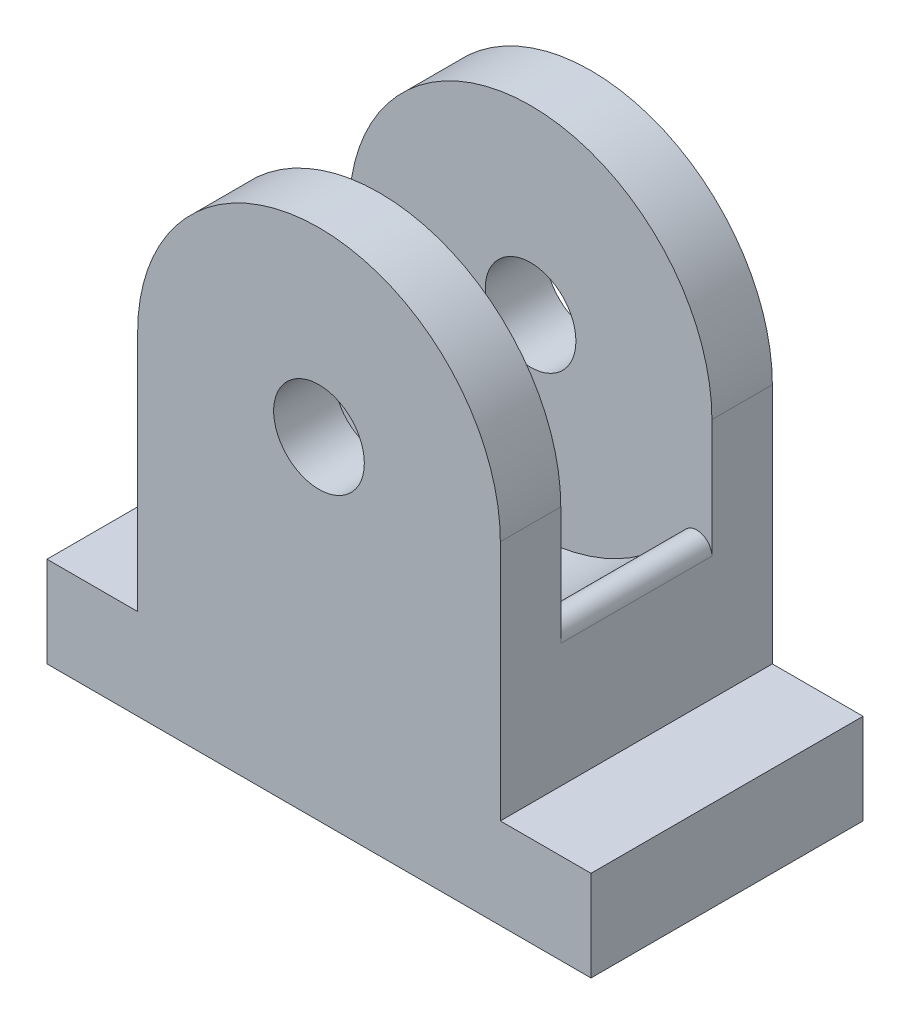
from build123d import *

# Parameters (mm, degrees)
SKETCH_1_R               = 1.5
EXTRUDE_1_DEPTH          = 2
SKETCH_2_W               = 18
SKETCH_2_H               = 3
EXTRUDE_2_DEPTH          = 2.5
EXTRUDE_3_DEPTH          = 2.5
FILLET_1_R               = 0.5
FILLET_2_R               = 0.5
CUT_EXTRUDE_1_DEPTH      = 22.236760582
CUT_EXTRUDE_1_DEPTH_BACK = 10
SKETCH_6_R               = 1.35


with BuildPart() as part:
    # 草图1 → 凸台-拉伸1 (new body)
    with BuildSketch(Plane.XY):
        with BuildLine():
            Line((-6, 0), (-6, -8))
            Line((-6, -8), (-9, -8))
            Line((-9, -8), (-9, -11))
            Line((-9, -11), (9, -11))
            Line((9, -11), (9, -8))
            Line((9, -8), (6, -8))
            Line((6, -8), (6, 0))
            ThreePointArc((6, 0), (0, 6), (-6, 0))
        make_face()
        Circle(SKETCH_1_R, mode=Mode.SUBTRACT)
    extrude(amount=EXTRUDE_1_DEPTH)

    # 草图2 → 凸台-拉伸2 (add)
    with BuildSketch(Plane.XY.offset(2)):
        with Locations((0, -9.5)):
            Rectangle(SKETCH_2_W, SKETCH_2_H)
    extrude(amount=EXTRUDE_2_DEPTH)

    # 草图5 → 凸台-拉伸3 (add)
    with BuildSketch(Plane.XY.offset(2)):
        with BuildLine():
            Line((6, -1.75), (6, -8))
            Line((6, -8), (-6, -8))
            Line((-6, -8), (-6, -1.75))
            ThreePointArc((-6, -1.75), (0, -6.25), (6, -1.75))
        make_face()
    extrude(amount=EXTRUDE_3_DEPTH)

    # 圆角1
    fillet_1_edges = [part.edges().sort_by_distance(p)[0] for p in [
        (-6, -1.75, 3.25),
    ]]
    fillet(fillet_1_edges, radius=FILLET_1_R)

    # 圆角2
    fillet_2_edges = [part.edges().sort_by_distance(p)[0] for p in [
        (6, -1.75, 3.25),
    ]]
    fillet(fillet_2_edges, radius=FILLET_2_R)

    # 镜向3: part across plane


with BuildPart() as part_1:
    add(part.part)
    add(part.part.mirror(Plane(origin=(0, 0, 4.5), x_dir=(1, 0, 0), z_dir=(0, 0, -1))))

    # 草图6 → 切除-拉伸1 (cut, two sides: drawn at the far end of the back side and taken through both)
    with BuildSketch(Plane.XZ.offset(11).offset(-CUT_EXTRUDE_1_DEPTH_BACK)):
        with Locations((0, 4.5)):
            Circle(SKETCH_6_R)
    extrude(amount=CUT_EXTRUDE_1_DEPTH + CUT_EXTRUDE_1_DEPTH_BACK, mode=Mode.SUBTRACT)


solid = part_1.part
